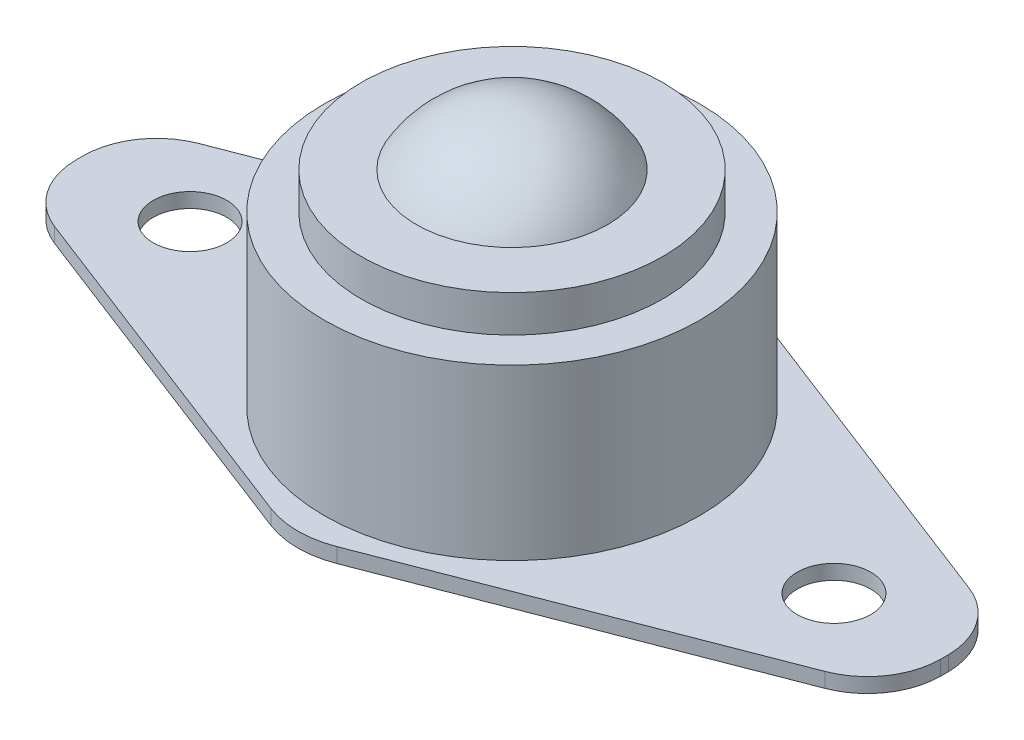
from build123d import *

# Parameters (mm, degrees)
CUT_EXTRUDE3_DEPTH      = 37.462309307
CUT_EXTRUDE3_DEPTH_BACK = 37.462309307
SKETCH2_R               = 2
CUT_EXTRUDE4_DEPTH      = 37.462309307
FILLET1_R               = 4
FILLET2_R               = 5


with BuildPart() as part:
    # Sketch1 → Revolve1 (revolve)
    with BuildSketch(Plane.XY, mode=Mode.PRIVATE) as revolve1_sk:
        with BuildLine():
            Line((-5.196152423, 12), (-8.196152423, 12))
            Line((-8.196152423, 12), (-8.196152423, 10))
            Line((-8.196152423, 10), (-10.196152423, 10))
            Line((-10.196152423, 10), (-10.196152423, 0.8))
            Line((-10.196152423, 0.8), (-23.5, 0.8))
            Line((-23.5, 0.8), (-23.5, 0))
            Line((-23.5, 0), (0, 0))
            Line((0, 0), (0, 15))
            ThreePointArc((0, 15), (-3, 14.196152423), (-5.196152423, 12))
        make_face()
    revolve(revolve1_sk.sketch.rotate(Axis((0, 0, 0), (0, 1, 0)), 270), axis=Axis((0, 0, 0), (0, 1, 0)))

    # Sketch2 → Cut-Extrude3 (cut, two sides: drawn at the far end of the back side and taken through both)
    with BuildSketch(Plane(origin=(0, 0, 0), x_dir=(1, 0, 0), z_dir=(0, 1, 0)).offset(-CUT_EXTRUDE3_DEPTH_BACK)):
        with Locations(Location((-17.5, 0, 0), (0, 0, 270))):
            Circle(SKETCH2_R)
        with Locations(Location((17.5, 0, 0), (0, 0, 270))):
            Circle(SKETCH2_R)
    extrude(amount=CUT_EXTRUDE3_DEPTH + CUT_EXTRUDE3_DEPTH_BACK, mode=Mode.SUBTRACT)

    # Sketch3 → Cut-Extrude4 (cut, through all)
    with BuildSketch(Plane(origin=(0, 0, 0), x_dir=(1, 0, 0), z_dir=(0, 1, 0))):
        with BuildLine():
            Line((-23.307724042, 3), (0, 12))
            Line((0, 12), (23.307724042, 3))
            ThreePointArc((23.307724042, 3), (0, 23.5), (-23.307724042, 3))
        make_face()
        with BuildLine():
            Line((0, -12), (23.307724042, -3))
            ThreePointArc((23.307724042, -3), (0, -23.5), (-23.307724042, -3))
            Line((-23.307724042, -3), (0, -12))
        make_face()
    extrude(amount=CUT_EXTRUDE4_DEPTH, mode=Mode.SUBTRACT)

    # Fillet1
    fillet1_edges = [part.edges().sort_by_distance(p)[0] for p in [
        (23.307724042, 0.4, -3),
        (-23.307724042, 0.4, -3),
        (-23.307724042, 0.4, 3),
        (23.307724042, 0.4, 3),
    ]]
    fillet(fillet1_edges, radius=FILLET1_R)

    # Fillet2
    fillet2_edges = [part.edges().sort_by_distance(p)[0] for p in [
        (0, 0.4, -12),
        (0, 0.4, 12),
    ]]
    fillet(fillet2_edges, radius=FILLET2_R)


solid = part.part
